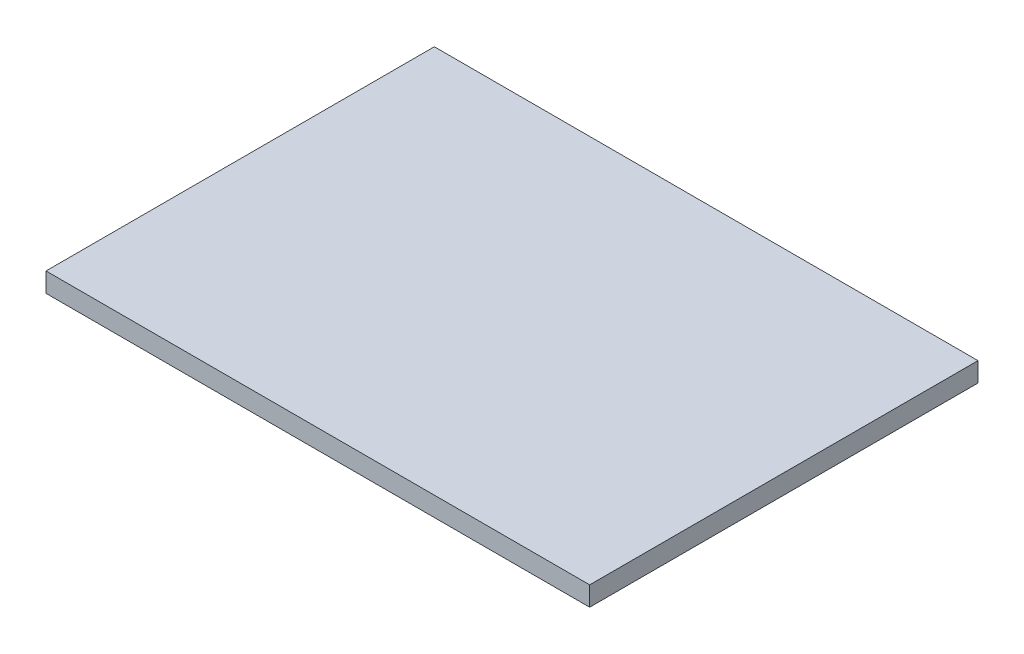
from build123d import *

# Parameters (mm, degrees)
SKETCH1_W           = 700
SKETCH1_H           = 500
BOSS_EXTRUDE1_DEPTH = 25


with BuildPart() as part:
    # Sketch1 → Boss-Extrude1 (new body)
    with BuildSketch(Plane(origin=(0, 0, 0), x_dir=(1, 0, 0), z_dir=(0, 1, 0))):
        with Locations((270.60330055, -219.243940657)):
            Rectangle(SKETCH1_W, SKETCH1_H)
    extrude(amount=BOSS_EXTRUDE1_DEPTH)


solid = part.part
